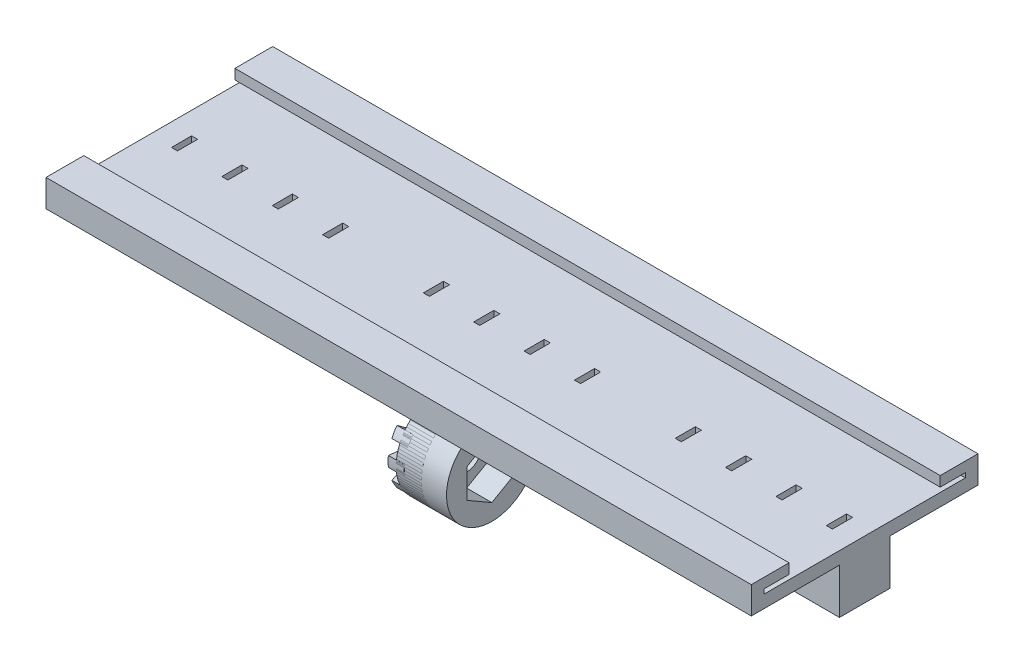
from build123d import *

# Parameters (mm, degrees)
CROQUIS1_W                  = 140
CROQUIS1_H                  = 45
SALIENTE_EXTRUIR1_DEPTH     = 2.5
CROQUIS2_W                  = 140
CROQUIS2_H                  = 2.5
SALIENTE_EXTRUIR2_DEPTH     = 0.9
CROQUIS3_W                  = 140
CROQUIS3_H                  = 7.5
SALIENTE_EXTRUIR3_DEPTH     = 2
CROQUIS4_W                  = 140
CROQUIS4_H                  = 10
CROQUIS4_W_2                = 137
CROQUIS4_H_2                = 7
SALIENTE_EXTRUIR4_DEPTH     = 9
SALIENTE_EXTRUIR5_DEPTH     = 10
SALIENTE_EXTRUIR20_DEPTH    = 1.6
SALIENTE_EXTRUIR20_2_DEPTH  = 1.6
SALIENTE_EXTRUIR20_3_DEPTH  = 1.6
SALIENTE_EXTRUIR20_4_DEPTH  = 1.6
SALIENTE_EXTRUIR20_5_DEPTH  = 1.6
SALIENTE_EXTRUIR20_6_DEPTH  = 1.6
SALIENTE_EXTRUIR20_7_DEPTH  = 1.6
SALIENTE_EXTRUIR20_8_DEPTH  = 1.6
SALIENTE_EXTRUIR20_9_DEPTH  = 1.6
SALIENTE_EXTRUIR20_10_DEPTH = 1.6
SALIENTE_EXTRUIR20_11_DEPTH = 1.6
SALIENTE_EXTRUIR20_12_DEPTH = 1.6
CROQUIS9_R                  = 9
CROQUIS9_R_2                = 3
SALIENTE_EXTRUIR24_DEPTH    = 5
CROQUIS10_W                 = 1.2
CROQUIS10_H                 = 4
CORTAR_EXTRUIR1_DEPTH       = 10
CROQUIS12_W                 = 1.2
CROQUIS12_H                 = 4
CORTAR_EXTRUIR2_DEPTH       = 10


with BuildPart() as part:
    # Croquis1 → Saliente-Extruir1 (new body)
    with BuildSketch(Plane(origin=(0, 0, 0), x_dir=(1, 0, 0), z_dir=(0, 1, 0))):
        with Locations((70, 22.5)):
            Rectangle(CROQUIS1_W, CROQUIS1_H)
    extrude(amount=SALIENTE_EXTRUIR1_DEPTH)

    # Croquis2 → Saliente-Extruir2 (add)
    with BuildSketch(Plane(origin=(0, 2.5, 0), x_dir=(1, 0, 0), z_dir=(0, 1, 0))):
        with Locations((70, 43.75)):
            Rectangle(CROQUIS2_W, CROQUIS2_H)
        with Locations((70, 1.25)):
            Rectangle(CROQUIS2_W, CROQUIS2_H)
    extrude(amount=SALIENTE_EXTRUIR2_DEPTH)

    # Croquis3 → Saliente-Extruir3 (add)
    with BuildSketch(Plane(origin=(0, 3.4, 0), x_dir=(1, 0, 0), z_dir=(0, 1, 0))):
        with Locations((70, 41.25)):
            Rectangle(CROQUIS3_W, CROQUIS3_H)
        with Locations((70, 3.75)):
            Rectangle(CROQUIS3_W, CROQUIS3_H)
    extrude(amount=SALIENTE_EXTRUIR3_DEPTH)

    # Croquis4 → Saliente-Extruir4 (add)
    with BuildSketch(Plane.XZ):
        with Locations((70, -22.5)):
            Rectangle(CROQUIS4_W, CROQUIS4_H)
        with Locations((70, -22.5)):
            Rectangle(CROQUIS4_W_2, CROQUIS4_H_2, mode=Mode.SUBTRACT)
    extrude(amount=SALIENTE_EXTRUIR4_DEPTH)

    # Croquis6 → Saliente-Extruir5 (add)
    with BuildSketch(Plane(origin=(70, 0, 0), x_dir=(0, 0, -1), z_dir=(1, 0, 0))):
        with BuildLine():
            Line((17.5, -9), (18.5, -9))
            Line((18.5, -9), (18.5, 1))
            Line((18.5, 1), (8.5, 1))
            Line((8.5, 1), (8.5, 0))
            ThreePointArc((8.5, 0), (2.136038969, -15.363961031), (17.5, -9))
        make_face()
        Polygon((8.5, -14.75), (13.479646072, -11.875), (13.479646072, -6.125), (8.5, -3.25), (3.520353928, -6.125), (3.520353928, -11.875), align=None, mode=Mode.SUBTRACT)
    extrude(amount=SALIENTE_EXTRUIR5_DEPTH)

    # Croquis10 → Cortar-Extruir1 (cut)
    with BuildSketch(Plane.XZ):
        with Locations((35, -22.5)):
            Rectangle(CROQUIS10_W, CROQUIS10_H)
        with Locations((25, -22.5)):
            Rectangle(CROQUIS10_W, CROQUIS10_H)
        with Locations((15, -22.5)):
            Rectangle(CROQUIS10_W, CROQUIS10_H)
        with Locations((5, -22.5)):
            Rectangle(CROQUIS10_W, CROQUIS10_H)
        with Locations((135, -22.5)):
            Rectangle(CROQUIS10_W, CROQUIS10_H)
        with Locations((125, -22.5)):
            Rectangle(CROQUIS10_W, CROQUIS10_H)
        with Locations((115, -22.5)):
            Rectangle(CROQUIS10_W, CROQUIS10_H)
        with Locations((105, -22.5)):
            Rectangle(CROQUIS10_W, CROQUIS10_H)
    extrude(amount=-CORTAR_EXTRUIR1_DEPTH, mode=Mode.SUBTRACT)

    # Croquis12 → Cortar-Extruir2 (cut)
    with BuildSketch(Plane.XZ):
        with Locations((85, -22.5)):
            Rectangle(CROQUIS12_W, CROQUIS12_H)
        with Locations((75, -22.5)):
            Rectangle(CROQUIS12_W, CROQUIS12_H)
        with Locations((65, -22.5)):
            Rectangle(CROQUIS12_W, CROQUIS12_H)
        with Locations((55, -22.5)):
            Rectangle(CROQUIS12_W, CROQUIS12_H)
    extrude(amount=-CORTAR_EXTRUIR2_DEPTH, mode=Mode.SUBTRACT)


with BuildPart() as body_2:
    # Croquis7 → Saliente-Extruir20 (new, symmetric)
    with BuildSketch(Plane.ZY.offset(-70)):
        with BuildLine():
            Line((-9.179219283, -3.038568866), (-9.518828924, -0.057853299))
            ThreePointArc((-9.518828924, -0.057853299), (-8.5, 0), (-7.481171076, -0.057853299))
            Line((-7.481171076, -0.057853299), (-7.820780717, -3.038568866))
            ThreePointArc((-7.820780717, -3.038568866), (-8.5, -3), (-9.179219283, -3.038568866))
        make_face()
    extrude(amount=SALIENTE_EXTRUIR20_DEPTH, both=True)


with BuildPart() as body_3:
    # Croquis7 → Saliente-Extruir20 2 (new, symmetric)
    with BuildSketch(Plane.ZY.offset(-70)):
        with BuildLine():
            Line((-4.931063279, -4.176858836), (-3.146594919, -1.765288254))
            ThreePointArc((-3.146594919, -1.765288254), (-4, -1.205771366), (-4.91125838, -0.746459331))
            Line((-4.91125838, -0.746459331), (-6.107505586, -3.497639554))
            ThreePointArc((-6.107505586, -3.497639554), (-5.5, -3.803847577), (-4.931063279, -4.176858836))
        make_face()
    extrude(amount=SALIENTE_EXTRUIR20_2_DEPTH, both=True)


with BuildPart() as body_4:
    # Croquis7 → Saliente-Extruir20 3 (new, symmetric)
    with BuildSketch(Plane.ZY.offset(-70)):
        with BuildLine():
            Line((-2.997639554, -6.607505586), (-0.246459331, -5.41125838))
            ThreePointArc((-0.246459331, -5.41125838), (-0.705771366, -4.5), (-1.265288254, -3.646594919))
            Line((-1.265288254, -3.646594919), (-3.676858836, -5.431063279))
            ThreePointArc((-3.676858836, -5.431063279), (-3.303847577, -6), (-2.997639554, -6.607505586))
        make_face()
    extrude(amount=SALIENTE_EXTRUIR20_3_DEPTH, both=True)


with BuildPart() as body_5:
    # Croquis7 → Saliente-Extruir20 4 (new, symmetric)
    with BuildSketch(Plane.ZY.offset(-70)):
        with BuildLine():
            Line((-2.538568866, -9.679219283), (0.442146701, -10.018828924))
            ThreePointArc((0.442146701, -10.018828924), (0.5, -9), (0.442146701, -7.981171076))
            Line((0.442146701, -7.981171076), (-2.538568866, -8.320780717))
            ThreePointArc((-2.538568866, -8.320780717), (-2.5, -9), (-2.538568866, -9.679219283))
        make_face()
    extrude(amount=SALIENTE_EXTRUIR20_4_DEPTH, both=True)


with BuildPart() as body_6:
    # Croquis7 → Saliente-Extruir20 5 (new, symmetric)
    with BuildSketch(Plane.ZY.offset(-70)):
        with BuildLine():
            Line((-3.676858836, -12.568936721), (-1.265288254, -14.353405081))
            ThreePointArc((-1.265288254, -14.353405081), (-0.705771366, -13.5), (-0.246459331, -12.58874162))
            Line((-0.246459331, -12.58874162), (-2.997639554, -11.392494414))
            ThreePointArc((-2.997639554, -11.392494414), (-3.303847577, -12), (-3.676858836, -12.568936721))
        make_face()
    extrude(amount=SALIENTE_EXTRUIR20_5_DEPTH, both=True)


with BuildPart() as body_7:
    # Croquis7 → Saliente-Extruir20 6 (new, symmetric)
    with BuildSketch(Plane.ZY.offset(-70)):
        with BuildLine():
            Line((-6.107505586, -14.502360446), (-4.91125838, -17.253540669))
            ThreePointArc((-4.91125838, -17.253540669), (-4, -16.794228634), (-3.146594919, -16.234711746))
            Line((-3.146594919, -16.234711746), (-4.931063279, -13.823141164))
            ThreePointArc((-4.931063279, -13.823141164), (-5.5, -14.196152423), (-6.107505586, -14.502360446))
        make_face()
    extrude(amount=SALIENTE_EXTRUIR20_6_DEPTH, both=True)


with BuildPart() as body_8:
    # Croquis7 → Saliente-Extruir20 7 (new, symmetric)
    with BuildSketch(Plane.ZY.offset(-70)):
        with BuildLine():
            Line((-9.179219283, -14.961431134), (-9.518828924, -17.942146701))
            ThreePointArc((-9.518828924, -17.942146701), (-8.5, -18), (-7.481171076, -17.942146701))
            Line((-7.481171076, -17.942146701), (-7.820780717, -14.961431134))
            ThreePointArc((-7.820780717, -14.961431134), (-8.5, -15), (-9.179219283, -14.961431134))
        make_face()
    extrude(amount=SALIENTE_EXTRUIR20_7_DEPTH, both=True)


with BuildPart() as body_9:
    # Croquis7 → Saliente-Extruir20 8 (new, symmetric)
    with BuildSketch(Plane.ZY.offset(-70)):
        with BuildLine():
            Line((-12.068936721, -13.823141164), (-13.853405081, -16.234711746))
            ThreePointArc((-13.853405081, -16.234711746), (-13, -16.794228634), (-12.08874162, -17.253540669))
            Line((-12.08874162, -17.253540669), (-10.892494414, -14.502360446))
            ThreePointArc((-10.892494414, -14.502360446), (-11.5, -14.196152423), (-12.068936721, -13.823141164))
        make_face()
    extrude(amount=SALIENTE_EXTRUIR20_8_DEPTH, both=True)


with BuildPart() as body_10:
    # Croquis7 → Saliente-Extruir20 9 (new, symmetric)
    with BuildSketch(Plane.ZY.offset(-70)):
        with BuildLine():
            Line((-14.002360446, -11.392494414), (-16.753540669, -12.58874162))
            ThreePointArc((-16.753540669, -12.58874162), (-16.294228634, -13.5), (-15.734711746, -14.353405081))
            Line((-15.734711746, -14.353405081), (-13.323141164, -12.568936721))
            ThreePointArc((-13.323141164, -12.568936721), (-13.696152423, -12), (-14.002360446, -11.392494414))
        make_face()
    extrude(amount=SALIENTE_EXTRUIR20_9_DEPTH, both=True)


with BuildPart() as body_11:
    # Croquis7 → Saliente-Extruir20 10 (new, symmetric)
    with BuildSketch(Plane.ZY.offset(-70)):
        with BuildLine():
            Line((-14.461431134, -8.320780717), (-17.442146701, -7.981171076))
            ThreePointArc((-17.442146701, -7.981171076), (-17.5, -9), (-17.442146701, -10.018828924))
            Line((-17.442146701, -10.018828924), (-14.461431134, -9.679219283))
            ThreePointArc((-14.461431134, -9.679219283), (-14.5, -9), (-14.461431134, -8.320780717))
        make_face()
    extrude(amount=SALIENTE_EXTRUIR20_10_DEPTH, both=True)


with BuildPart() as body_12:
    # Croquis7 → Saliente-Extruir20 11 (new, symmetric)
    with BuildSketch(Plane.ZY.offset(-70)):
        with BuildLine():
            Line((-13.323141164, -5.431063279), (-15.734711746, -3.646594919))
            ThreePointArc((-15.734711746, -3.646594919), (-16.294228634, -4.5), (-16.753540669, -5.41125838))
            Line((-16.753540669, -5.41125838), (-14.002360446, -6.607505586))
            ThreePointArc((-14.002360446, -6.607505586), (-13.696152423, -6), (-13.323141164, -5.431063279))
        make_face()
    extrude(amount=SALIENTE_EXTRUIR20_11_DEPTH, both=True)


with BuildPart() as body_13:
    # Croquis7 → Saliente-Extruir20 12 (new, symmetric)
    with BuildSketch(Plane.ZY.offset(-70)):
        with BuildLine():
            Line((-10.892494414, -3.497639554), (-12.08874162, -0.746459331))
            ThreePointArc((-12.08874162, -0.746459331), (-13, -1.205771366), (-13.853405081, -1.765288254))
            Line((-13.853405081, -1.765288254), (-12.068936721, -4.176858836))
            ThreePointArc((-12.068936721, -4.176858836), (-11.5, -3.803847577), (-10.892494414, -3.497639554))
        make_face()
    extrude(amount=SALIENTE_EXTRUIR20_12_DEPTH, both=True)


with BuildPart() as body_14:
    # Croquis9 → Saliente-Extruir24 (new body)
    with BuildSketch(Plane(origin=(75, 0, 0), x_dir=(0, 0, -1), z_dir=(1, 0, 0))):
        with Locations((8.5, -9)):
            Circle(CROQUIS9_R)
        with Locations((8.5, -9)):
            Circle(CROQUIS9_R_2, mode=Mode.SUBTRACT)
    extrude(amount=-SALIENTE_EXTRUIR24_DEPTH)


solid = Compound([part.part, body_2.part, body_3.part, body_4.part, body_5.part, body_6.part, body_7.part, body_8.part, body_9.part, body_10.part, body_11.part, body_12.part, body_13.part, body_14.part])
